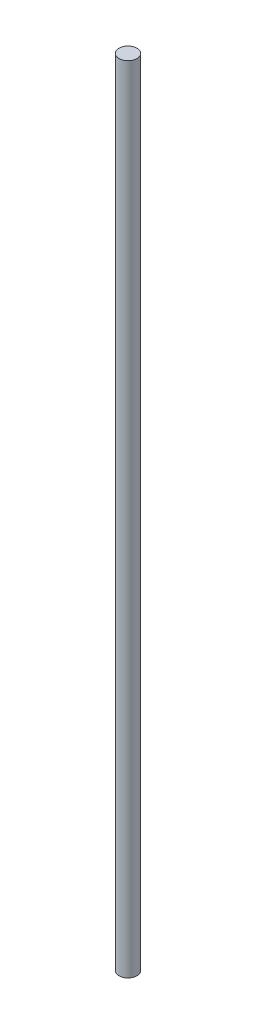
from build123d import *

# Parameters (mm, degrees)
SKETCH1_R           = 3.175
BOSS_EXTRUDE1_DEPTH = 280.416


with BuildPart() as part:
    # Sketch1 → Boss-Extrude1 (new body)
    with BuildSketch(Plane(origin=(0, 0, 0), x_dir=(1, 0, 0), z_dir=(0, 1, 0))):
        with Locations(Location((0, 0, 0), (0, 0, 270))):
            Circle(SKETCH1_R)
    extrude(amount=BOSS_EXTRUDE1_DEPTH)


solid = part.part
